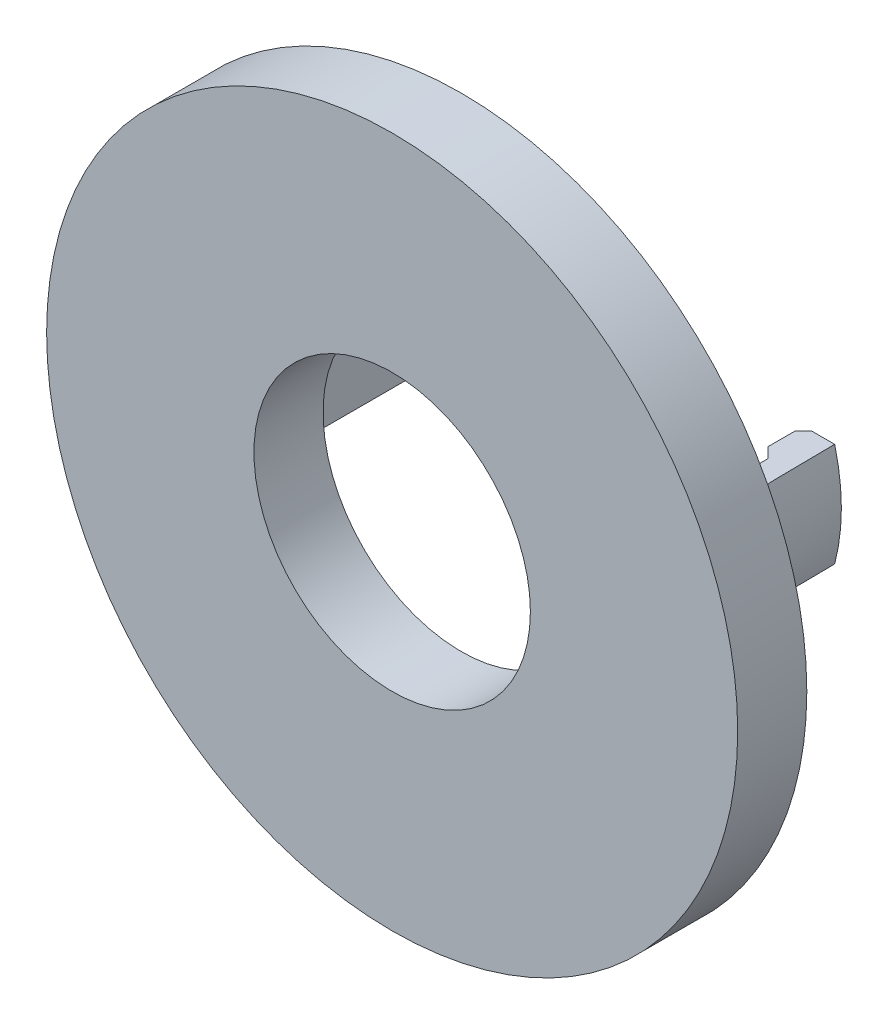
from build123d import *

# Parameters (mm, degrees)
SKETCH4_R           = 25
BOSS_EXTRUDE2_DEPTH = 5
SKETCH5_R           = 10
CUT_EXTRUDE1_DEPTH  = 36.707142143
BOSS_EXTRUDE3_DEPTH = 3.75
SKETCH1_R           = 25
CUT_EXTRUDE2_DEPTH  = 38.584072424


with BuildPart() as part:
    # Sketch4 → Boss-Extrude2 (new body)
    with BuildSketch(Plane.XY):
        Circle(SKETCH4_R)
    extrude(amount=BOSS_EXTRUDE2_DEPTH)

    # Sketch5 → Cut-Extrude1 (cut, through all)
    with BuildSketch(Plane.XY.offset(5)):
        Circle(SKETCH5_R)
    extrude(amount=-CUT_EXTRUDE1_DEPTH, mode=Mode.SUBTRACT)

    # Sketch6 → Boss-Extrude3 (add, symmetric)
    with BuildSketch(Plane(origin=(0, 0, 0), x_dir=(1, 0, 0), z_dir=(0, 1, 0))):
        Polygon((15.5, 12.75), (12.603553391, 12.75), (12, 12.146446609), (12, 10.207106781), (12.75, 9.457106781), (12.75, 2.396446609), (10.353553391, 0), (15.5, 0), align=None)
    boss_extrude3 = extrude(amount=BOSS_EXTRUDE3_DEPTH, both=True)

    # Sketch1 → Cut-Extrude2 (cut, through all)
    with BuildSketch(Plane.XY):
        Circle(SKETCH1_R)
        with BuildLine():
            ThreePointArc((-1, 15.467708298), (10.600707524, 11.308182878), (15.5, 0))
            ThreePointArc((15.5, 0), (10.600707524, -11.308182878), (-1, -15.467708298))
            ThreePointArc((-1, -15.467708298), (-17.5, 0), (-1, 15.467708298))
        make_face(mode=Mode.SUBTRACT)
    cut_extrude2 = extrude(amount=-CUT_EXTRUDE2_DEPTH, mode=Mode.SUBTRACT)

    # Sketch6<4> → Cut-Revolve1 (revolve, cut)
    with BuildSketch(Plane(origin=(0, 0, 0), x_dir=(1, 0, 0), z_dir=(0, 1, 0))):
        with BuildLine():
            add(Edge.make_bspline(
                [(14.75, 12.75), (14.75, 3.446446626), (15.5, 0)],
                knots=[0, 0, 0, 1, 1, 1], degree=2))
            Line((15.5, 0), (15.5, 12.75))
            Line((15.5, 12.75), (14.75, 12.75))
        make_face()
    cut_revolve1 = revolve(axis=Axis((0, 0, 0), (0, 0, -1)), mode=Mode.SUBTRACT)

    # Mirror1: Boss-Extrude3, Cut-Extrude2, Cut-Revolve1 across plane
    add(boss_extrude3.mirror(Plane(origin=(0, 0, 0), x_dir=(0, 0, 1), z_dir=(1, 0, 0))))
    add(cut_extrude2.mirror(Plane(origin=(0, 0, 0), x_dir=(0, 0, 1), z_dir=(1, 0, 0))), mode=Mode.SUBTRACT)
    add(cut_revolve1.mirror(Plane(origin=(0, 0, 0), x_dir=(0, 0, 1), z_dir=(1, 0, 0))), mode=Mode.SUBTRACT)


solid = part.part
